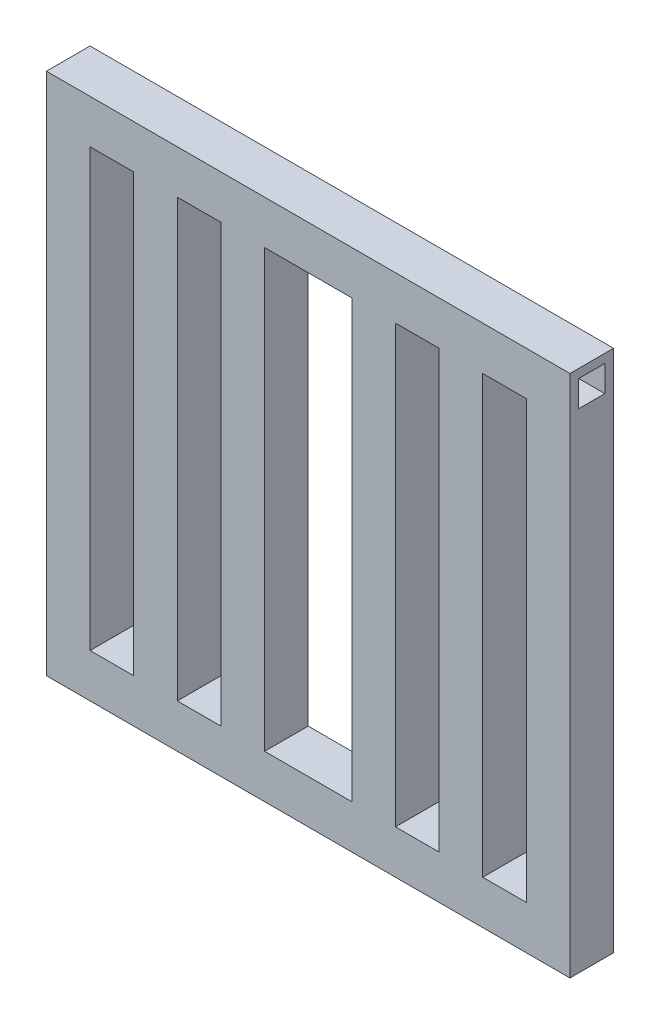
from build123d import *

# Parameters (mm, degrees)
SKETCH1_W           = 152.4
SKETCH1_H           = 152.4
BOSS_EXTRUDE1_DEPTH = 12.7
SKETCH2_W           = 12.7
SKETCH2_H           = 127
CUT_EXTRUDE1_DEPTH  = 12.7
SKETCH3_W           = 7.62
SKETCH3_H           = 7.62
CUT_EXTRUDE2_DEPTH  = 25.4
SKETCH4_W           = 7.62
SKETCH4_H           = 7.62
CUT_EXTRUDE3_DEPTH  = 25.4
SKETCH5_W           = 7.62
SKETCH5_H           = 7.62
CUT_EXTRUDE4_DEPTH  = 25.4


with BuildPart() as part:
    # Sketch1 → Boss-Extrude1 (new body)
    with BuildSketch(Plane.XY):
        with Locations((-76.2, 76.2)):
            Rectangle(SKETCH1_W, SKETCH1_H)
    extrude(amount=BOSS_EXTRUDE1_DEPTH)

    # Sketch2 → Cut-Extrude1 (cut)
    with BuildSketch(Plane.XY.offset(12.7)):
        with Locations((-133.35, 76.2)):
            Rectangle(SKETCH2_W, SKETCH2_H)
        with Locations((-19.05, 76.2)):
            Rectangle(SKETCH2_W, SKETCH2_H)
        with Locations((-44.45, 76.2)):
            Rectangle(SKETCH2_W, SKETCH2_H)
        with Locations((-107.95, 76.2)):
            Rectangle(SKETCH2_W, SKETCH2_H)
        with Locations((-82.55, 76.2)):
            Rectangle(SKETCH2_W, SKETCH2_H)
        with Locations((-69.85, 76.2)):
            Rectangle(SKETCH2_W, SKETCH2_H)
    extrude(amount=-CUT_EXTRUDE1_DEPTH, mode=Mode.SUBTRACT)

    # Sketch3 → Cut-Extrude2 (cut)
    with BuildSketch(Plane(origin=(0, 0, 0), x_dir=(0, 0, -1), z_dir=(1, 0, 0))):
        with Locations((-6.35, 146.05)):
            Rectangle(SKETCH3_W, SKETCH3_H)
    extrude(amount=-CUT_EXTRUDE2_DEPTH, mode=Mode.SUBTRACT)

    # Sketch4 → Cut-Extrude3 (cut)
    with BuildSketch(Plane.ZY.offset(152.4)):
        with Locations((6.35, 146.05)):
            Rectangle(SKETCH4_W, SKETCH4_H)
    extrude(amount=-CUT_EXTRUDE3_DEPTH, mode=Mode.SUBTRACT)

    # Sketch5 → Cut-Extrude4 (cut)
    with BuildSketch(Plane.XZ):
        with Locations((-6.35, 6.35)):
            Rectangle(SKETCH5_W, SKETCH5_H)
    extrude(amount=-CUT_EXTRUDE4_DEPTH, mode=Mode.SUBTRACT)


solid = part.part
